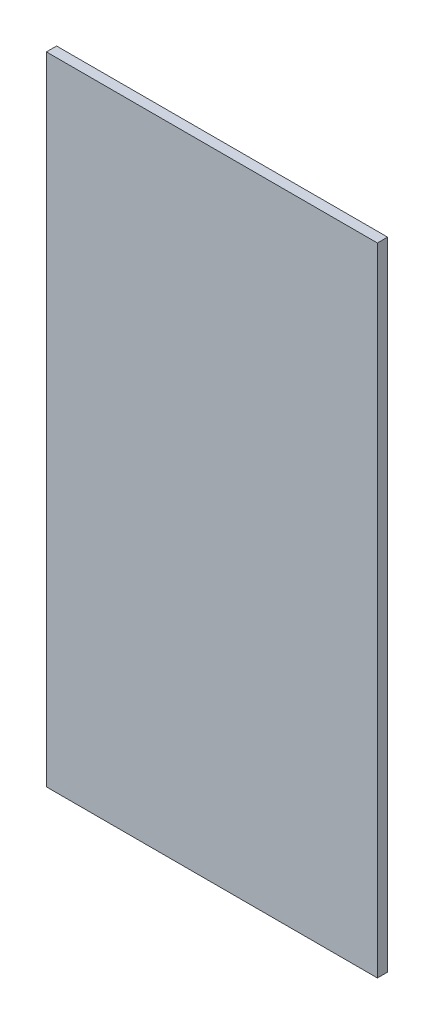
from build123d import *

# Parameters (mm, degrees)
SKETCH1_W           = 52
SKETCH1_H           = 100
BOSS_EXTRUDE1_DEPTH = 1.6


with BuildPart() as part:
    # Sketch1 → Boss-Extrude1 (new body)
    with BuildSketch(Plane.XY):
        with Locations((26, 50)):
            Rectangle(SKETCH1_W, SKETCH1_H)
    extrude(amount=BOSS_EXTRUDE1_DEPTH)


solid = part.part
